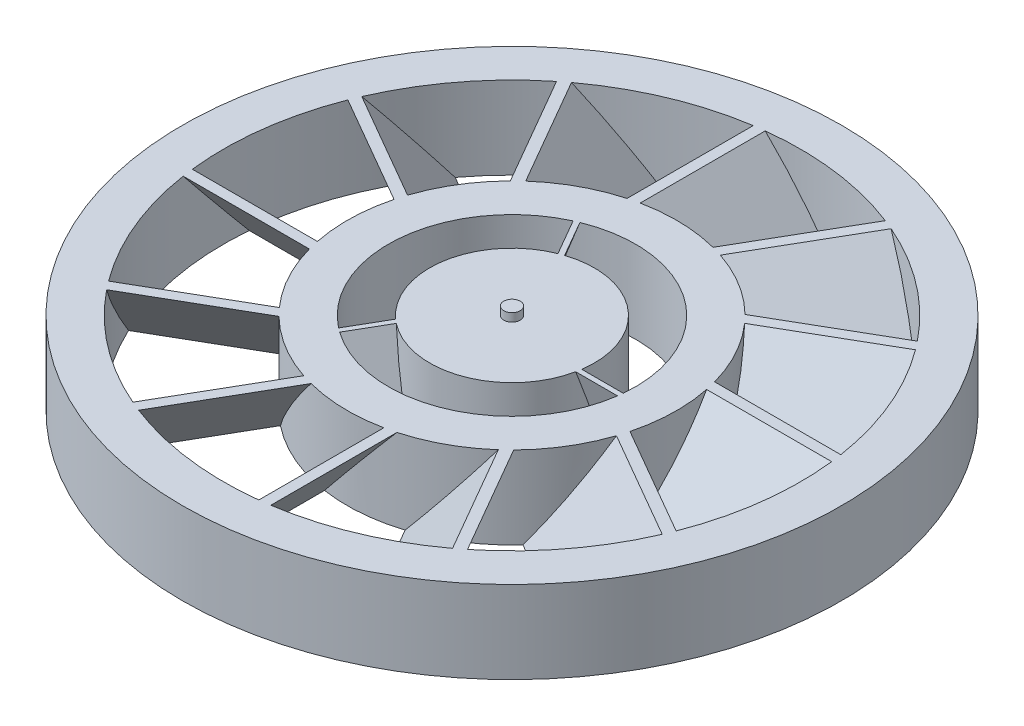
from build123d import *

# Parameters (mm, degrees)
SKETCH1_R                            = 10
BOSS_EXTRUDE1_DEPTH                  = 10
SKETCH1_R_2                          = 20
SKETCH1_R_3                          = 15
BOSS_EXTRUDE1_2_DEPTH                = 10
SKETCH1_R_4                          = 40
SKETCH1_R_5                          = 35
BOSS_EXTRUDE1_3_DEPTH                = 10
BOSS_EXTRUDE2_REACH                  = 89.446
BOSS_EXTRUDE2_END_RADIUS             = 35
BOSS_EXTRUDE2_START                  = 30
BOSS_EXTRUDE2_DIRECTION_2_REACH      = 89.446
BOSS_EXTRUDE2_DIRECTION_2_END_RADIUS = 20
CIRPATTERN1_COUNT                    = 12
BOSS_EXTRUDE3_START                  = 9.76079
BOSS_EXTRUDE3_DEPTH                  = 5.23921
CIRPATTERN3_COUNT                    = 3
SKETCH6_R                            = 1
BOSS_EXTRUDE4_DEPTH                  = 1


with BuildPart() as part:
    # Sketch1 → Boss-Extrude1 (new body)
    with BuildSketch(Plane(origin=(0, 0, 0), x_dir=(1, 0, 0), z_dir=(0, 1, 0))):
        with Locations(Location((0, 0, 0), (0, 0, 270))):
            Circle(SKETCH1_R)
    extrude(amount=BOSS_EXTRUDE1_DEPTH)



with BuildPart() as body_2:
    # Sketch1 → Boss-Extrude1 2 (new body)
    with BuildSketch(Plane(origin=(0, 0, 0), x_dir=(1, 0, 0), z_dir=(0, 1, 0))):
        with Locations(Location((0, 0, 0), (0, 0, 270))):
            Circle(SKETCH1_R_2)
        with Locations(Location((0, 0, 0), (0, 0, 270))):
            Circle(SKETCH1_R_3, mode=Mode.SUBTRACT)
    extrude(amount=BOSS_EXTRUDE1_2_DEPTH)


with BuildPart() as body_3:
    # Sketch1 → Boss-Extrude1 3 (new body)
    with BuildSketch(Plane(origin=(0, 0, 0), x_dir=(1, 0, 0), z_dir=(0, 1, 0))):
        with Locations(Location((0, 0, 0), (0, 0, 270))):
            Circle(SKETCH1_R_4)
        with Locations(Location((0, 0, 0), (0, 0, 270))):
            Circle(SKETCH1_R_5, mode=Mode.SUBTRACT)
    extrude(amount=BOSS_EXTRUDE1_3_DEPTH)


    add(body_2.part)  # Boss-Extrude2 merges body 2
    # Boss-Extrude2: up to this cylinder (the profile starts inside it)
    boss_extrude2_end = Plane(origin=(0, 5, 0), z_dir=(0, -1, 0)) * Cylinder(BOSS_EXTRUDE2_END_RADIUS, 249.892, mode=Mode.PRIVATE)
    # Sketch4 → Boss-Extrude2 (add, up to the surface)
    with BuildSketch(Plane(origin=(0, 0, 0), x_dir=(0, 0, -1), z_dir=(1, 0, 0)).offset(BOSS_EXTRUDE2_START), mode=Mode.PRIVATE) as boss_extrude2_sk1:
        Polygon((-4.262410526, 0), (4.031443844, 10), (5.315133993, 10), (-2.978720377, 0), align=None)
    boss_extrude2_tool1 = extrude(boss_extrude2_sk1.sketch, amount=BOSS_EXTRUDE2_REACH, mode=Mode.PRIVATE) & boss_extrude2_end
    boss_extrude2 = boss_extrude2_tool1.solids().sort_by_distance((30, 5, -0.526362))[0]
    add(boss_extrude2)

    # Boss-Extrude2 direction 2: up to this cylinder (the profile starts outside it)
    boss_extrude2_direction_2_end = Plane(origin=(0, 5, 0), z_dir=(0, -1, 0)) * Cylinder(BOSS_EXTRUDE2_DIRECTION_2_END_RADIUS, 219.892, mode=Mode.PRIVATE)
    # Sketch4 → Boss-Extrude2 direction 2 (add, up to the surface)
    with BuildSketch(Plane(origin=(0, 0, 0), x_dir=(0, 0, -1), z_dir=(1, 0, 0)).offset(BOSS_EXTRUDE2_START), mode=Mode.PRIVATE) as boss_extrude2_direction_2_sk1:
        Polygon((-4.262410526, 0), (4.031443844, 10), (5.315133993, 10), (-2.978720377, 0), align=None)
    boss_extrude2_direction_2_tool1 = extrude(boss_extrude2_direction_2_sk1.sketch, amount=-BOSS_EXTRUDE2_DIRECTION_2_REACH, mode=Mode.PRIVATE) - boss_extrude2_direction_2_end
    boss_extrude2_direction_2 = boss_extrude2_direction_2_tool1.solids().sort_by_distance((30, 5, -0.526362))[0]
    add(boss_extrude2_direction_2)
    boss_extrude2 = boss_extrude2 + boss_extrude2_direction_2  # both directions under the feature's name, for the pattern or mirror that repeats it

    # CirPattern1: Boss-Extrude2 ×12 about axis
    cirpattern1_axis = Axis((0, 0, 0), (0, 1, 0))
    for i in range(1, CIRPATTERN1_COUNT):
        add(boss_extrude2.rotate(cirpattern1_axis, i * 360 / CIRPATTERN1_COUNT))


with BuildPart() as part_1:
    add(part.part)

    add(body_3.part)  # Boss-Extrude3 merges body 3
    # Sketch5 → Boss-Extrude3 (add)
    with BuildSketch(Plane(origin=(0, 0, 0), x_dir=(0, 0, -1), z_dir=(1, 0, 0)).offset(BOSS_EXTRUDE3_START)):
        Polygon((-2.0524403, 10), (1.416675924, 0), (2.174160553, 0), (-1.428789261, 10), align=None)
    boss_extrude3 = extrude(amount=BOSS_EXTRUDE3_DEPTH)

    # CirPattern3: Boss-Extrude3 ×3 about axis
    cirpattern3_axis = Axis((0, 0, 0), (0, 1, 0))
    for i in range(1, CIRPATTERN3_COUNT):
        add(boss_extrude3.rotate(cirpattern3_axis, i * 360 / CIRPATTERN3_COUNT))

    # Sketch6 → Boss-Extrude4 (add)
    with BuildSketch(Plane(origin=(0, 10, 0), x_dir=(1, 0, 0), z_dir=(0, 1, 0))):
        with Locations(Location((0, 0, 0), (0, 0, 270))):
            Circle(SKETCH6_R)
    extrude(amount=BOSS_EXTRUDE4_DEPTH)


solid = part_1.part
